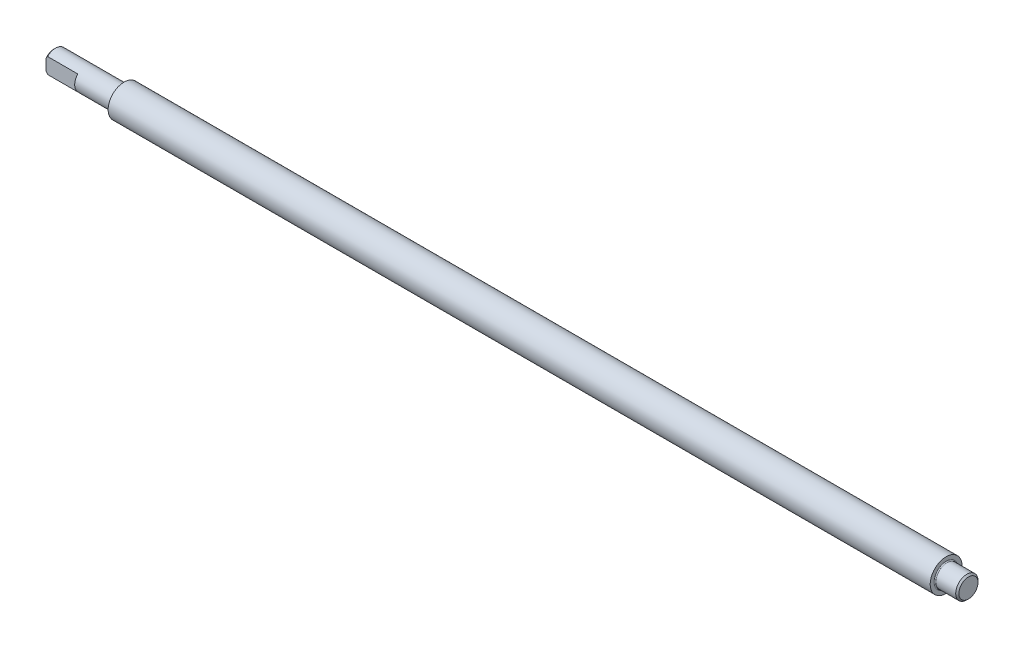
from build123d import *

# Parameters (mm, degrees)
SKETCH1_W           = 258
SKETCH1_H           = 5
SKETCH2_R           = 3.5
BOSS_EXTRUDE1_DEPTH = 22
CUT_EXTRUDE1_START  = -10
CUT_EXTRUDE1_DEPTH  = 10
BOSS_EXTRUDE2_START = 7
SKETCH4_R           = 3.5
BOSS_EXTRUDE2_DEPTH = 7
CHAMFER1_SIZE       = 0.5
FILLET1_R           = 0.3


with BuildPart() as part:
    # Sketch1 → Revolve1 (revolve)
    with BuildSketch(Plane.XY, mode=Mode.PRIVATE) as revolve1_sk:
        with Locations((151, 2.5)):
            Rectangle(SKETCH1_W, SKETCH1_H)
    revolve(revolve1_sk.sketch.rotate(Axis((22, 0, 0), (1, 0, 0)), 270), axis=Axis((22, 0, 0), (1, 0, 0)))

    # Sketch2 → Boss-Extrude1 (add)
    with BuildSketch(Plane.ZY.offset(-22)):
        Circle(SKETCH2_R)
    extrude(amount=BOSS_EXTRUDE1_DEPTH)

    # Sketch3 → Cut-Extrude1 (cut)
    with BuildSketch(Plane.ZY.offset(CUT_EXTRUDE1_START)):
        with BuildLine():
            Line((2.5, 2.449489743), (2.5, -2.449489743))
            ThreePointArc((2.5, -2.449489743), (3.5, 0), (2.5, 2.449489743))
        make_face()
    extrude(amount=CUT_EXTRUDE1_DEPTH, mode=Mode.SUBTRACT)

    # Sketch4 → Boss-Extrude2 (add)
    with BuildSketch(Plane(origin=(280, 0, 0), x_dir=(0, 0, -1), z_dir=(1, 0, 0)).offset(BOSS_EXTRUDE2_START)):
        with Locations(Location((0, 0, 0), (0, 0, 135.584691403))):
            Circle(SKETCH4_R)
    extrude(amount=-BOSS_EXTRUDE2_DEPTH)

    # Chamfer1
    chamfer1_edges = [part.edges().sort_by_distance(p)[0] for p in [
        (287, -2.449489743, -2.5),
        (0, 0, -3.5),
    ]]
    chamfer(chamfer1_edges, length=CHAMFER1_SIZE)

    # Fillet1
    fillet1_edges = [part.edges().sort_by_distance(p)[0] for p in [
        (280, -2.449489743, -2.5),
        (22, 0, -3.5),
    ]]
    fillet(fillet1_edges, radius=FILLET1_R)


solid = part.part
